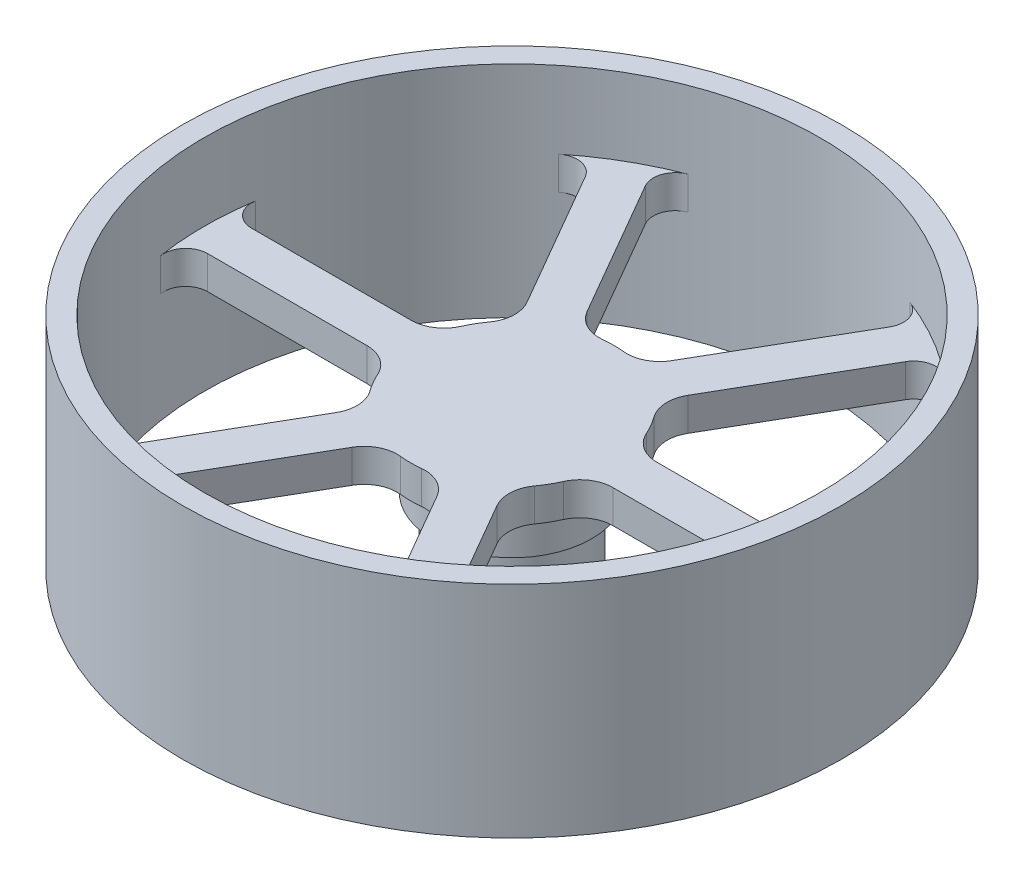
from build123d import *
from build123d.topology import SkipClean

# Parameters (mm, degrees)
SKETCH1_R           = 30
SKETCH1_R_2         = 28
BOSS_EXTRUDE1_DEPTH = 10
SKETCH2_R           = 28
BOSS_EXTRUDE2_DEPTH = 3
SKETCH3_R           = 7.25
BOSS_EXTRUDE3_DEPTH = 4
SKETCH4_R           = 6
BOSS_EXTRUDE4_DEPTH = 11.7
SKETCH5_R           = 1.425
CUT_EXTRUDE1_DEPTH  = 9
CUT_EXTRUDE2_DEPTH  = 9
CUT_EXTRUDE3_DEPTH  = 10


with BuildPart() as part:
    # Sketch1 → Boss-Extrude1 (new, symmetric)
    with BuildSketch(Plane(origin=(0, 0, 0), x_dir=(1, 0, 0), z_dir=(0, 1, 0))):
        with Locations(Location((0, 0, 0), (0, 0, 270))):
            Circle(SKETCH1_R)
        with Locations(Location((0, 0, 0), (0, 0, 270))):
            Circle(SKETCH1_R_2, mode=Mode.SUBTRACT)
    extrude(amount=BOSS_EXTRUDE1_DEPTH, both=True)

    # Sketch2 → Boss-Extrude2 (add)
    with BuildSketch(Plane(origin=(0, 0, 0), x_dir=(1, 0, 0), z_dir=(0, 1, 0))):
        with Locations(Location((0, 0, 0), (0, 0, 270))):
            Circle(SKETCH2_R)
    extrude(amount=BOSS_EXTRUDE2_DEPTH)

    # Sketch3 → Boss-Extrude3 (add)
    with BuildSketch(Plane.XZ):
        with Locations(Location((0, 0, 0), (0, 0, 90))):
            Circle(SKETCH3_R)
    extrude(amount=BOSS_EXTRUDE3_DEPTH)

    # Sketch4 → Boss-Extrude4 (add)
    with BuildSketch(Plane.XZ.offset(4)):
        with Locations(Location((0, 0, 0), (0, 0, 270))):
            Circle(SKETCH4_R)
    extrude(amount=BOSS_EXTRUDE4_DEPTH)

    # Sketch5 → Cut-Extrude1 (cut)
    with BuildSketch(Plane.XZ.offset(15.7)):
        with Locations(Location((0, 0, 0), (0, 0, 270))):
            Circle(SKETCH5_R)
    extrude(amount=-CUT_EXTRUDE1_DEPTH, mode=Mode.SUBTRACT)

    # Sketch6 → Cut-Extrude2 (cut)
    with BuildSketch(Plane.XZ):
        with BuildLine():
            ThreePointArc((6.431343192, 22.602827804), (0, 23.5), (-6.431343192, 22.602827804))
            ThreePointArc((-6.431343192, 22.602827804), (-8.390723522, 20.844019161), (-8.208396868, 18.217360425))
            Line((-8.208396868, 18.217360425), (-3.859516504, 10.684878678))
            ThreePointArc((-3.859516504, 10.684878678), (-2.62549924, 9.51292374), (-0.952516139, 9.200826757))
            ThreePointArc((-0.952516139, 9.200826757), (0, 9.25), (0.952516139, 9.200826757))
            ThreePointArc((0.952516139, 9.200826757), (2.62549924, 9.51292374), (3.859516504, 10.684878678))
            Line((3.859516504, 10.684878678), (8.208396868, 18.217360425))
            ThreePointArc((8.208396868, 18.217360425), (8.390723522, 20.844019161), (6.431343192, 22.602827804))
        make_face()
        with BuildLine():
            ThreePointArc((8.444407777, 3.775510204), (8.010734985, 4.625), (7.491891637, 5.425316552))
            ThreePointArc((7.491891637, 5.425316552), (6.925684003, 7.03021091), (7.323618119, 8.684878678))
            Line((7.323618119, 8.684878678), (11.672498484, 16.217360425))
            ThreePointArc((11.672498484, 16.217360425), (13.856088349, 17.688589307), (16.35895148, 16.871120487))
            ThreePointArc((16.35895148, 16.871120487), (20.351596989, 11.75), (22.790294672, 5.731707317))
            ThreePointArc((22.790294672, 5.731707317), (22.246811871, 3.155429854), (19.880895352, 2))
            Line((19.880895352, 2), (11.183134623, 2))
            ThreePointArc((11.183134623, 2), (9.551183243, 2.48271283), (8.444407777, 3.775510204))
        make_face()
        with BuildLine():
            ThreePointArc((7.491891637, -5.425316552), (8.010734985, -4.625), (8.444407777, -3.775510204))
            ThreePointArc((8.444407777, -3.775510204), (9.551183243, -2.48271283), (11.183134623, -2))
            Line((11.183134623, -2), (19.880895352, -2))
            ThreePointArc((19.880895352, -2), (22.246811871, -3.155429854), (22.790294672, -5.731707317))
            ThreePointArc((22.790294672, -5.731707317), (20.351596989, -11.75), (16.35895148, -16.871120487))
            ThreePointArc((16.35895148, -16.871120487), (13.856088349, -17.688589307), (11.672498484, -16.217360425))
            Line((11.672498484, -16.217360425), (7.323618119, -8.684878678))
            ThreePointArc((7.323618119, -8.684878678), (6.925684003, -7.03021091), (7.491891637, -5.425316552))
        make_face()
        with BuildLine():
            ThreePointArc((-0.952516139, -9.200826757), (0, -9.25), (0.952516139, -9.200826757))
            ThreePointArc((0.952516139, -9.200826757), (2.62549924, -9.51292374), (3.859516504, -10.684878678))
            Line((3.859516504, -10.684878678), (8.208396868, -18.217360425))
            ThreePointArc((8.208396868, -18.217360425), (8.390723522, -20.844019161), (6.431343192, -22.602827804))
            ThreePointArc((6.431343192, -22.602827804), (0, -23.5), (-6.431343192, -22.602827804))
            ThreePointArc((-6.431343192, -22.602827804), (-8.390723522, -20.844019161), (-8.208396868, -18.217360425))
            Line((-8.208396868, -18.217360425), (-3.859516504, -10.684878678))
            ThreePointArc((-3.859516504, -10.684878678), (-2.62549924, -9.51292374), (-0.952516139, -9.200826757))
        make_face()
        with BuildLine():
            ThreePointArc((-8.444407777, -3.775510204), (-8.010734985, -4.625), (-7.491891637, -5.425316552))
            ThreePointArc((-7.491891637, -5.425316552), (-6.925684003, -7.03021091), (-7.323618119, -8.684878678))
            Line((-7.323618119, -8.684878678), (-11.672498484, -16.217360425))
            ThreePointArc((-11.672498484, -16.217360425), (-13.856088349, -17.688589307), (-16.35895148, -16.871120487))
            ThreePointArc((-16.35895148, -16.871120487), (-20.351596989, -11.75), (-22.790294672, -5.731707317))
            ThreePointArc((-22.790294672, -5.731707317), (-22.246811871, -3.155429854), (-19.880895352, -2))
            Line((-19.880895352, -2), (-11.183134623, -2))
            ThreePointArc((-11.183134623, -2), (-9.551183243, -2.48271283), (-8.444407777, -3.775510204))
        make_face()
        with BuildLine():
            ThreePointArc((-7.491891637, 5.425316552), (-8.010734985, 4.625), (-8.444407777, 3.775510204))
            ThreePointArc((-8.444407777, 3.775510204), (-9.551183243, 2.48271283), (-11.183134623, 2))
            Line((-11.183134623, 2), (-19.880895352, 2))
            ThreePointArc((-19.880895352, 2), (-22.246811871, 3.155429854), (-22.790294672, 5.731707317))
            ThreePointArc((-22.790294672, 5.731707317), (-20.351596989, 11.75), (-16.35895148, 16.871120487))
            ThreePointArc((-16.35895148, 16.871120487), (-13.856088349, 17.688589307), (-11.672498484, 16.217360425))
            Line((-11.672498484, 16.217360425), (-7.323618119, 8.684878678))
            ThreePointArc((-7.323618119, 8.684878678), (-6.925684003, 7.03021091), (-7.491891637, 5.425316552))
        make_face()
    extrude(amount=-CUT_EXTRUDE2_DEPTH, mode=Mode.SUBTRACT)

    # Sketch7 → Cut-Extrude3 (cut)
    with SkipClean():  # the faces are left unmerged after this step: merging them gives an invalid solid
        with BuildSketch(Plane.XZ):
            with BuildLine():
                ThreePointArc((6.431343192, 22.602827804), (8.390723522, 20.844019161), (8.208396868, 18.217360425))
                Line((8.208396868, 18.217360425), (11.113181771, 23.248595461))
                ThreePointArc((11.113181771, 23.248595461), (11.267286913, 24.913738855), (10.102756422, 26.113872035))
                ThreePointArc((10.102756422, 26.113872035), (2.31e-07, 28), (-10.102755992, 26.113872202))
                ThreePointArc((-10.102755992, 26.113872202), (-11.267286836, 24.913739072), (-11.113181771, 23.248595461))
                Line((-11.113181771, 23.248595461), (-8.208396868, 18.217360425))
                ThreePointArc((-8.208396868, 18.217360425), (-8.390723522, 20.844019161), (-6.431343192, 22.602827804))
                ThreePointArc((-6.431343192, 22.602827804), (0, 23.5), (6.431343192, 22.602827804))
            make_face()
            with BuildLine():
                ThreePointArc((27.666654785, 4.307692308), (24.248711421, 13.9999998), (17.563898722, 21.806179438))
                ThreePointArc((17.563898722, 21.806179438), (15.942287522, 22.214626168), (14.577283386, 21.248595461))
                Line((14.577283386, 21.248595461), (11.672498484, 16.217360425))
                ThreePointArc((11.672498484, 16.217360425), (13.856088349, 17.688589307), (16.35895148, 16.871120487))
                ThreePointArc((16.35895148, 16.871120487), (20.351596989, 11.75), (22.790294672, 5.731707317))
                ThreePointArc((22.790294672, 5.731707317), (22.246811871, 3.155429854), (19.880895352, 2))
                Line((19.880895352, 2), (25.690465157, 2))
                ThreePointArc((25.690465157, 2), (27.209574208, 2.699112729), (27.666654785, 4.307692308))
            make_face()
            with BuildLine():
                ThreePointArc((17.563898363, -21.806179728), (24.248711191, -14.0000002), (27.666654714, -4.307692764))
                ThreePointArc((27.666654714, -4.307692764), (27.209574358, -2.699112904), (25.690465157, -2))
                Line((25.690465157, -2), (19.880895352, -2))
                ThreePointArc((19.880895352, -2), (22.246811871, -3.155429854), (22.790294672, -5.731707317))
                ThreePointArc((22.790294672, -5.731707317), (20.351596989, -11.75), (16.35895148, -16.871120487))
                ThreePointArc((16.35895148, -16.871120487), (13.856088349, -17.688589307), (11.672498484, -16.217360425))
                Line((11.672498484, -16.217360425), (14.577283386, -21.248595461))
                ThreePointArc((14.577283386, -21.248595461), (15.942287295, -22.214626126), (17.563898363, -21.806179728))
            make_face()
            with BuildLine():
                ThreePointArc((-10.102756422, -26.113872035), (-2.31e-07, -28), (10.102755992, -26.113872202))
                ThreePointArc((10.102755992, -26.113872202), (11.267286836, -24.913739072), (11.113181771, -23.248595461))
                Line((11.113181771, -23.248595461), (8.208396868, -18.217360425))
                ThreePointArc((8.208396868, -18.217360425), (8.390723522, -20.844019161), (6.431343192, -22.602827804))
                ThreePointArc((6.431343192, -22.602827804), (0, -23.5), (-6.431343192, -22.602827804))
                ThreePointArc((-6.431343192, -22.602827804), (-8.390723522, -20.844019161), (-8.208396868, -18.217360425))
                Line((-8.208396868, -18.217360425), (-11.113181771, -23.248595461))
                ThreePointArc((-11.113181771, -23.248595461), (-11.267286913, -24.913738855), (-10.102756422, -26.113872035))
            make_face()
            with BuildLine():
                ThreePointArc((-25.690465157, -2), (-27.209574208, -2.699112729), (-27.666654785, -4.307692308))
                ThreePointArc((-27.666654785, -4.307692308), (-24.248711421, -13.9999998), (-17.563898722, -21.806179438))
                ThreePointArc((-17.563898722, -21.806179438), (-15.942287522, -22.214626168), (-14.577283386, -21.248595461))
                Line((-14.577283386, -21.248595461), (-11.672498484, -16.217360425))
                ThreePointArc((-11.672498484, -16.217360425), (-13.856088349, -17.688589307), (-16.35895148, -16.871120487))
                ThreePointArc((-16.35895148, -16.871120487), (-20.351596989, -11.75), (-22.790294672, -5.731707317))
                ThreePointArc((-22.790294672, -5.731707317), (-22.246811871, -3.155429854), (-19.880895352, -2))
                Line((-19.880895352, -2), (-25.690465157, -2))
            make_face()
            with BuildLine():
                ThreePointArc((-14.577283386, 21.248595461), (-15.942287295, 22.214626126), (-17.563898363, 21.806179728))
                ThreePointArc((-17.563898363, 21.806179728), (-24.248711191, 14.0000002), (-27.666654714, 4.307692764))
                ThreePointArc((-27.666654714, 4.307692764), (-27.209574358, 2.699112904), (-25.690465157, 2))
                Line((-25.690465157, 2), (-19.880895352, 2))
                ThreePointArc((-19.880895352, 2), (-22.246811871, 3.155429854), (-22.790294672, 5.731707317))
                ThreePointArc((-22.790294672, 5.731707317), (-20.351596989, 11.75), (-16.35895148, 16.871120487))
                ThreePointArc((-16.35895148, 16.871120487), (-13.856088349, 17.688589307), (-11.672498484, 16.217360425))
                Line((-11.672498484, 16.217360425), (-14.577283386, 21.248595461))
            make_face()
        extrude(amount=-CUT_EXTRUDE3_DEPTH, mode=Mode.SUBTRACT)


solid = part.part
